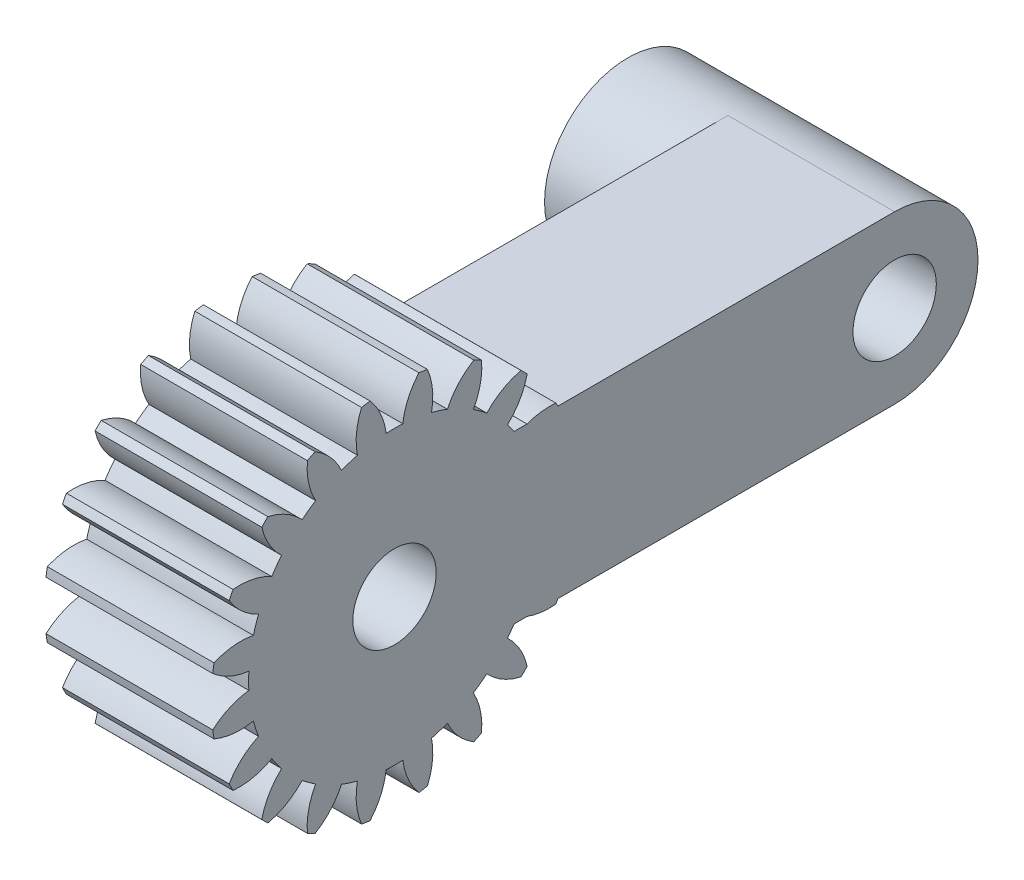
from build123d import *

# Parameters (mm, degrees)
SKETCH1_R           = 2.5
BOSS_EXTRUDE1_DEPTH = 10
SKETCH2_R           = 2.5
BOSS_EXTRUDE2_DEPTH = 10
SKETCH3_R           = 5
SKETCH3_R_2         = 2.5
BOSS_EXTRUDE3_DEPTH = 6
SKETCH4_R           = 2.5
CUT_EXTRUDE1_DEPTH  = 6


with BuildPart() as part:
    # Sketch1 → Boss-Extrude1 (new body)
    with BuildSketch(Plane(origin=(4.043870029, 0, 0), x_dir=(0, 0, -1), z_dir=(1, 0, 0))):
        with BuildLine():
            ThreePointArc((-10.029541992, 0.342879069), (-9.019080639, -0.304016541), (-7.862233613, -0.622153359))
            ThreePointArc((-7.862233613, -0.622153359), (-7.876528296, -1.122077366), (-7.862233613, -1.622001374))
            ThreePointArc((-7.862233613, -1.622001374), (-9.019080639, -1.940138191), (-10.029541992, -2.587033801))
            ThreePointArc((-10.029541992, -2.587033801), (-9.992100042, -2.842856482), (-9.948655897, -3.097728508))
            ThreePointArc((-9.948655897, -3.097728508), (-8.787748306, -3.400713063), (-7.58921172, -3.345793765))
            ThreePointArc((-7.58921172, -3.345793765), (-7.448321757, -3.82566705), (-7.280241692, -4.296705735))
            ThreePointArc((-7.280241692, -4.296705735), (-8.282158911, -4.956757219), (-9.043263028, -5.884241235))
            ThreePointArc((-9.043263028, -5.884241235), (-8.928600062, -6.115972863), (-8.808522437, -6.344945585))
            ThreePointArc((-8.808522437, -6.344945585), (-7.610806331, -6.274360846), (-6.487901298, -5.851761317))
            ThreePointArc((-6.487901298, -5.851761317), (-6.20561798, -6.264610538), (-5.90020538, -6.660655353))
            ThreePointArc((-5.90020538, -6.660655353), (-6.649118154, -7.598011066), (-7.086362862, -8.715294889))
            ThreePointArc((-7.086362862, -8.715294889), (-6.905702889, -8.900251959), (-6.720745819, -9.080911932))
            ThreePointArc((-6.720745819, -9.080911932), (-5.603461996, -8.643667224), (-4.666106283, -7.89475445))
            ThreePointArc((-4.666106283, -7.89475445), (-4.270061468, -8.20016705), (-3.857212247, -8.482450368))
            ThreePointArc((-3.857212247, -8.482450368), (-4.279811776, -9.605355401), (-4.350396515, -10.803071507))
            ThreePointArc((-4.350396515, -10.803071507), (-4.121423793, -10.923149132), (-3.889692165, -11.037812099))
            ThreePointArc((-3.889692165, -11.037812099), (-2.962208149, -10.276707981), (-2.302156665, -9.274790762))
            ThreePointArc((-2.302156665, -9.274790762), (-1.83111798, -9.442870827), (-1.351244695, -9.583760791))
            ThreePointArc((-1.351244695, -9.583760791), (-1.406163992, -10.782297376), (-1.103179437, -11.943204968))
            ThreePointArc((-1.103179437, -11.943204968), (-0.848307411, -11.986649113), (-0.592484731, -12.024091063))
            ThreePointArc((-0.592484731, -12.024091063), (0.054410879, -11.01362971), (0.372547697, -9.856782684))
            ThreePointArc((0.372547697, -9.856782684), (0.872471704, -9.871077366), (1.372395712, -9.856782684))
            ThreePointArc((1.372395712, -9.856782684), (1.690532529, -11.01362971), (2.337428139, -12.024091063))
            ThreePointArc((2.337428139, -12.024091063), (2.59325082, -11.986649113), (2.848122846, -11.943204968))
            ThreePointArc((2.848122846, -11.943204968), (3.151107401, -10.782297376), (3.096188103, -9.583760791))
            ThreePointArc((3.096188103, -9.583760791), (3.576061388, -9.442870827), (4.047100073, -9.274790762))
            ThreePointArc((4.047100073, -9.274790762), (4.707151558, -10.276707981), (5.634635573, -11.037812099))
            ThreePointArc((5.634635573, -11.037812099), (5.866367201, -10.923149132), (6.095339923, -10.803071507))
            ThreePointArc((6.095339923, -10.803071507), (6.024755184, -9.605355401), (5.602155655, -8.482450368))
            ThreePointArc((5.602155655, -8.482450368), (6.015004877, -8.20016705), (6.411049691, -7.89475445))
            ThreePointArc((6.411049691, -7.89475445), (7.348405404, -8.643667224), (8.465689227, -9.080911932))
            ThreePointArc((8.465689227, -9.080911932), (8.650646297, -8.900251959), (8.83130627, -8.715294889))
            ThreePointArc((8.83130627, -8.715294889), (8.394061563, -7.598011066), (7.645148788, -6.660655353))
            ThreePointArc((7.645148788, -6.660655353), (7.950561388, -6.264610538), (8.232844706, -5.851761317))
            ThreePointArc((8.232844706, -5.851761317), (9.355749739, -6.274360846), (10.553465846, -6.344945585))
            ThreePointArc((10.553465846, -6.344945585), (10.67354347, -6.115972863), (10.788206437, -5.884241235))
            ThreePointArc((10.788206437, -5.884241235), (10.02710232, -4.956757219), (9.0251851, -4.296705735))
            ThreePointArc((9.0251851, -4.296705735), (9.193265165, -3.82566705), (9.334155129, -3.345793765))
            ThreePointArc((9.334155129, -3.345793765), (10.532691714, -3.400713063), (11.693599306, -3.097728508))
            ThreePointArc((11.693599306, -3.097728508), (11.737043451, -2.842856482), (11.774485401, -2.587033801))
            ThreePointArc((11.774485401, -2.587033801), (10.764024048, -1.940138191), (9.607177022, -1.622001374))
            ThreePointArc((9.607177022, -1.622001374), (9.621471704, -1.122077366), (9.607177022, -0.622153359))
            ThreePointArc((9.607177022, -0.622153359), (10.764024048, -0.304016541), (11.774485401, 0.342879069))
            ThreePointArc((11.774485401, 0.342879069), (11.737043451, 0.598701749), (11.693599306, 0.853573775))
            ThreePointArc((11.693599306, 0.853573775), (10.532691714, 1.156558331), (9.334155129, 1.101639033))
            ThreePointArc((9.334155129, 1.101639033), (9.193265165, 1.581512318), (9.0251851, 2.052551003))
            ThreePointArc((9.0251851, 2.052551003), (10.02710232, 2.712602487), (10.788206437, 3.640086503))
            ThreePointArc((10.788206437, 3.640086503), (10.67354347, 3.871818131), (10.553465846, 4.100790853))
            ThreePointArc((10.553465846, 4.100790853), (9.355749739, 4.030206114), (8.232844706, 3.607606585))
            ThreePointArc((8.232844706, 3.607606585), (7.950561388, 4.020455806), (7.645148788, 4.416500621))
            ThreePointArc((7.645148788, 4.416500621), (8.394061563, 5.353856334), (8.83130627, 6.471140157))
            ThreePointArc((8.83130627, 6.471140157), (8.650646297, 6.656097227), (8.465689227, 6.8367572))
            ThreePointArc((8.465689227, 6.8367572), (7.348405404, 6.399512492), (6.411049691, 5.650599718))
            ThreePointArc((6.411049691, 5.650599718), (6.015004877, 5.956012318), (5.602155655, 6.238295636))
            ThreePointArc((5.602155655, 6.238295636), (6.024755184, 7.361200669), (6.095339923, 8.558916775))
            ThreePointArc((6.095339923, 8.558916775), (5.866367201, 8.6789944), (5.634635573, 8.793657366))
            ThreePointArc((5.634635573, 8.793657366), (4.707151558, 8.032553249), (4.047100073, 7.03063603))
            ThreePointArc((4.047100073, 7.03063603), (3.576061388, 7.198716095), (3.096188103, 7.339606058))
            ThreePointArc((3.096188103, 7.339606058), (3.151107401, 8.538142644), (2.848122846, 9.699050235))
            ThreePointArc((2.848122846, 9.699050235), (2.59325082, 9.74249438), (2.337428139, 9.779936331))
            ThreePointArc((2.337428139, 9.779936331), (1.690532529, 8.769474978), (1.372395712, 7.612627952))
            ThreePointArc((1.372395712, 7.612627952), (0.872471704, 7.626922634), (0.372547697, 7.612627952))
            ThreePointArc((0.372547697, 7.612627952), (0.054410879, 8.769474978), (-0.592484731, 9.779936331))
            ThreePointArc((-0.592484731, 9.779936331), (-0.848307411, 9.74249438), (-1.103179437, 9.699050235))
            ThreePointArc((-1.103179437, 9.699050235), (-1.406163992, 8.538142644), (-1.351244695, 7.339606058))
            ThreePointArc((-1.351244695, 7.339606058), (-1.83111798, 7.198716095), (-2.302156665, 7.03063603))
            ThreePointArc((-2.302156665, 7.03063603), (-2.962208149, 8.032553249), (-3.889692165, 8.793657366))
            ThreePointArc((-3.889692165, 8.793657366), (-4.121423793, 8.6789944), (-4.350396515, 8.558916775))
            ThreePointArc((-4.350396515, 8.558916775), (-4.279811776, 7.361200669), (-3.857212247, 6.238295636))
            ThreePointArc((-3.857212247, 6.238295636), (-4.270061468, 5.956012318), (-4.666106283, 5.650599718))
            ThreePointArc((-4.666106283, 5.650599718), (-5.603461996, 6.399512492), (-6.720745819, 6.8367572))
            ThreePointArc((-6.720745819, 6.8367572), (-6.905702889, 6.656097227), (-7.086362862, 6.471140157))
            ThreePointArc((-7.086362862, 6.471140157), (-6.649118154, 5.353856334), (-5.90020538, 4.416500621))
            ThreePointArc((-5.90020538, 4.416500621), (-6.20561798, 4.020455806), (-6.487901298, 3.607606585))
            ThreePointArc((-6.487901298, 3.607606585), (-7.610806331, 4.030206114), (-8.808522437, 4.100790853))
            ThreePointArc((-8.808522437, 4.100790853), (-8.928600062, 3.871818131), (-9.043263028, 3.640086503))
            ThreePointArc((-9.043263028, 3.640086503), (-8.282158911, 2.712602487), (-7.280241692, 2.052551003))
            ThreePointArc((-7.280241692, 2.052551003), (-7.448321757, 1.581512318), (-7.58921172, 1.101639033))
            ThreePointArc((-7.58921172, 1.101639033), (-8.787748306, 1.156558331), (-9.948655897, 0.853573775))
            ThreePointArc((-9.948655897, 0.853573775), (-9.992100042, 0.598701749), (-10.029541992, 0.342879069))
        make_face()
        with Locations(Location((0.872471704, -1.122077366, 0), (0, 0, 180))):
            Circle(SKETCH1_R, mode=Mode.SUBTRACT)
    extrude(amount=-BOSS_EXTRUDE1_DEPTH)

    # Sketch2 → Boss-Extrude2 (add)
    with BuildSketch(Plane(origin=(4.043870029, 0, 0), x_dir=(0, 0, -1), z_dir=(1, 0, 0))):
        with BuildLine():
            Line((0.872471704, 3.877922634), (30.872471704, 3.877922634))
            ThreePointArc((30.872471704, 3.877922634), (35.872471704, -1.122077366), (30.872471704, -6.122077366))
            Line((30.872471704, -6.122077366), (0.872471704, -6.122077366))
            ThreePointArc((0.872471704, -6.122077366), (-4.127528296, -1.122077366), (0.872471704, 3.877922634))
        make_face()
        with Locations((30.872471704, -1.122077366)):
            Circle(SKETCH2_R, mode=Mode.SUBTRACT)
    extrude(amount=-BOSS_EXTRUDE2_DEPTH)

    # Sketch3 → Boss-Extrude3 (add)
    with BuildSketch(Plane.ZY.offset(5.956129971)):
        with Locations(Location((-30.872471704, -1.122077366, 0), (0, 0, 270))):
            Circle(SKETCH3_R)
        with Locations(Location((-30.872471704, -1.122077366, 0), (0, 0, 180))):
            Circle(SKETCH3_R_2, mode=Mode.SUBTRACT)
    extrude(amount=BOSS_EXTRUDE3_DEPTH)

    # Sketch4 → Cut-Extrude1 (cut)
    with BuildSketch(Plane(origin=(4.043870029, 0, 0), x_dir=(0, 0, -1), z_dir=(1, 0, 0))):
        with Locations((0.872471704, -1.122077366)):
            Circle(SKETCH4_R)
    extrude(amount=-CUT_EXTRUDE1_DEPTH, mode=Mode.SUBTRACT)


solid = part.part
